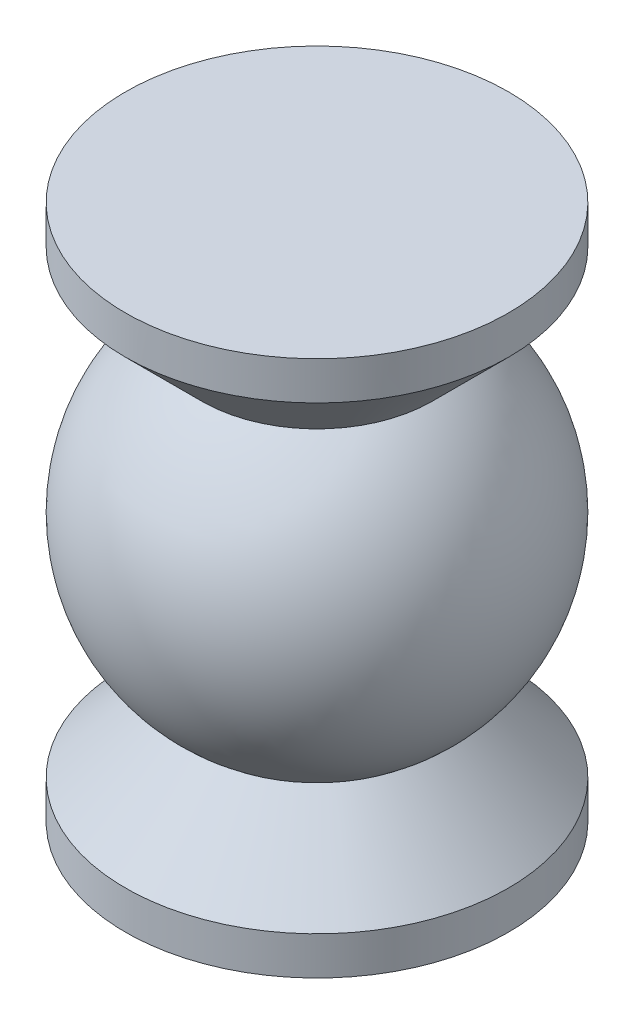
from build123d import *


with BuildPart() as part:
    # 草图1 → 旋转1 (revolve)
    with BuildSketch(Plane.XY, mode=Mode.PRIVATE) as revolve_1_sk:
        with BuildLine():
            Line((0, 0), (25, 0))
            Line((25, 0), (25, 5))
            Line((25, 5), (15, 15))
            ThreePointArc((15, 15), (25, 35), (15, 55))
            Line((15, 55), (25, 65))
            Line((25, 65), (25, 70))
            Line((25, 70), (0, 70))
            Line((0, 70), (0, 0))
        make_face()
    revolve(revolve_1_sk.sketch.rotate(Axis((0, 0, 0), (0, 1, 0)), 90), axis=Axis((0, 0, 0), (0, 1, 0)))


solid = part.part
